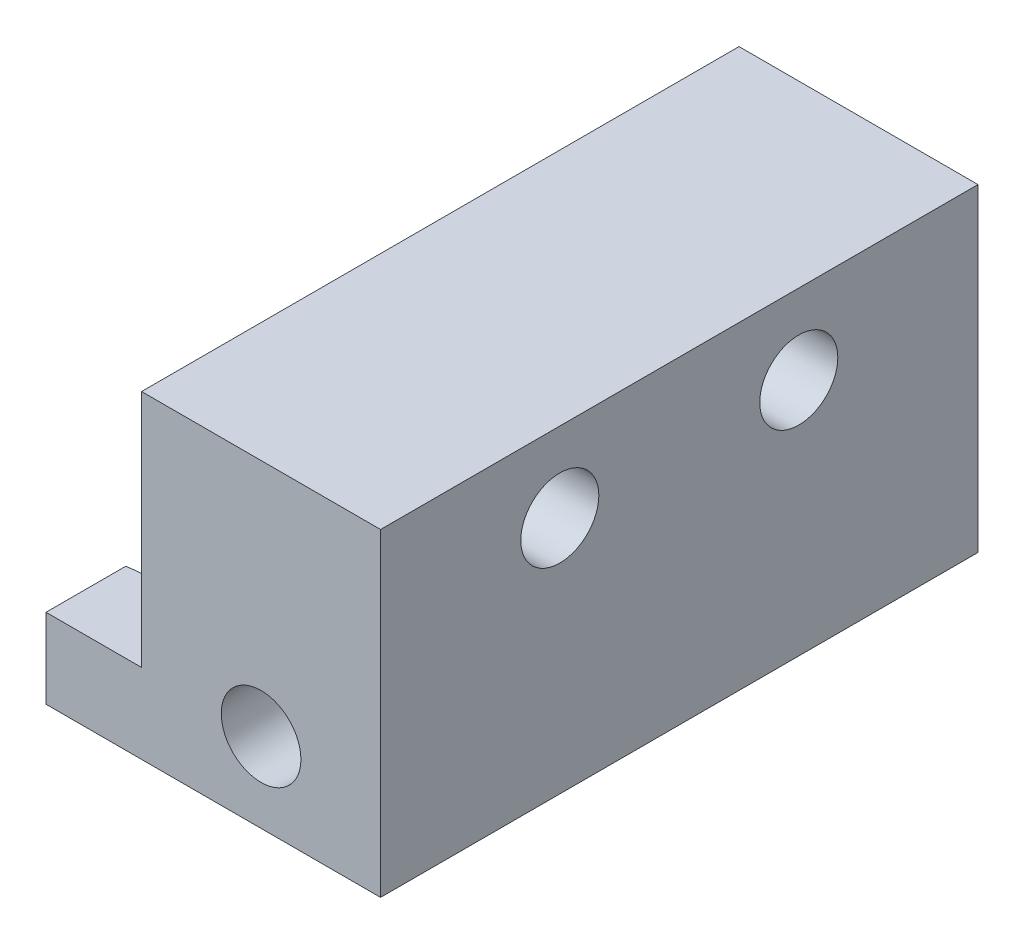
from build123d import *

# Parameters (mm, degrees)
SKETCH1_W             = 30
SKETCH1_H             = 75
MAIN_BLOCK_DEPTH      = 20
FRAME_HOLE_REACH      = 81.057
SKETCH2_R             = 5
EM_ROD_HOLES_REACH    = 54.022
EM_ROD_HOLES_SKETCH_R = 4.9
SKETCH4_W             = 12
SKETCH4_H             = 75
BOSS_EXTRUDE1_DEPTH   = 10
CUT_EXTRUDE1_DEPTH    = 62.116691664


with BuildPart() as part:
    # Sketch1 → Main Block (new, symmetric)
    with BuildSketch(Plane(origin=(0, 0, 0), x_dir=(1, 0, 0), z_dir=(0, 1, 0))):
        Rectangle(SKETCH1_W, SKETCH1_H)
    extrude(amount=MAIN_BLOCK_DEPTH, both=True)

    # Sketch2 → Frame Hole (cut, up to next)
    with BuildSketch(Plane.XY.offset(37.5), mode=Mode.PRIVATE) as frame_hole_sk1:
        with Locations((0, -10)):
            Circle(SKETCH2_R)
    frame_hole_tool1 = extrude(frame_hole_sk1.sketch, amount=-FRAME_HOLE_REACH, mode=Mode.PRIVATE) & part.part
    add(frame_hole_tool1.solids().sort_by_distance((0, -10, 37.5))[0], mode=Mode.SUBTRACT)

    # EM Rod Holes Sketch → EM Rod Holes (cut, up to next)
    with BuildSketch(Plane(origin=(15, 0, 0), x_dir=(0, 0, -1), z_dir=(1, 0, 0)), mode=Mode.PRIVATE) as em_rod_holes_sk1:
        with Locations((-15, 10)):
            Circle(EM_ROD_HOLES_SKETCH_R)
    em_rod_holes_tool1 = extrude(em_rod_holes_sk1.sketch, amount=-EM_ROD_HOLES_REACH, mode=Mode.PRIVATE) & part.part
    # EM Rod Holes Sketch → EM Rod Holes (cut, up to next)
    with BuildSketch(Plane(origin=(15, 0, 0), x_dir=(0, 0, -1), z_dir=(1, 0, 0)), mode=Mode.PRIVATE) as em_rod_holes_sk2:
        with Locations((15, 10)):
            Circle(EM_ROD_HOLES_SKETCH_R)
    em_rod_holes_tool2 = extrude(em_rod_holes_sk2.sketch, amount=-EM_ROD_HOLES_REACH, mode=Mode.PRIVATE) & part.part
    add(em_rod_holes_tool1.solids().sort_by_distance((15, 10, 15))[0], mode=Mode.SUBTRACT)
    add(em_rod_holes_tool2.solids().sort_by_distance((15, 10, -15))[0], mode=Mode.SUBTRACT)

    # Sketch4 → Boss-Extrude1 (add)
    with BuildSketch(Plane.XZ.offset(20)):
        with Locations((-21, 0)):
            Rectangle(SKETCH4_W, SKETCH4_H)
    extrude(amount=-BOSS_EXTRUDE1_DEPTH)

    # Sketch6 → Cut-Extrude1 (cut, symmetric)
    with BuildSketch(Plane.XZ.offset(20)):
        with BuildLine():
            ThreePointArc((-25, 27.3), (-26.004987562, 27.350124379), (-27, 27.5))
            Line((-27, 27.5), (-27, 25.5))
            ThreePointArc((-27, 25.5), (-26.004987562, 25.649875621), (-25, 25.7))
            ThreePointArc((-25, 25.7), (-24.858578644, 25.641421356), (-24.8, 25.5))
            Line((-24.8, 25.5), (-15, 25.5))
            Line((-15, 25.5), (-15, 27.5))
            Line((-15, 27.5), (-24.8, 27.5))
            ThreePointArc((-24.8, 27.5), (-24.858578644, 27.358578644), (-25, 27.3))
        make_face()
    cut_extrude1 = extrude(amount=CUT_EXTRUDE1_DEPTH, both=True, mode=Mode.SUBTRACT)

    # Mirror1: Cut-Extrude1 across plane
    add(cut_extrude1.mirror(Plane.XY), mode=Mode.SUBTRACT)


solid = part.part
